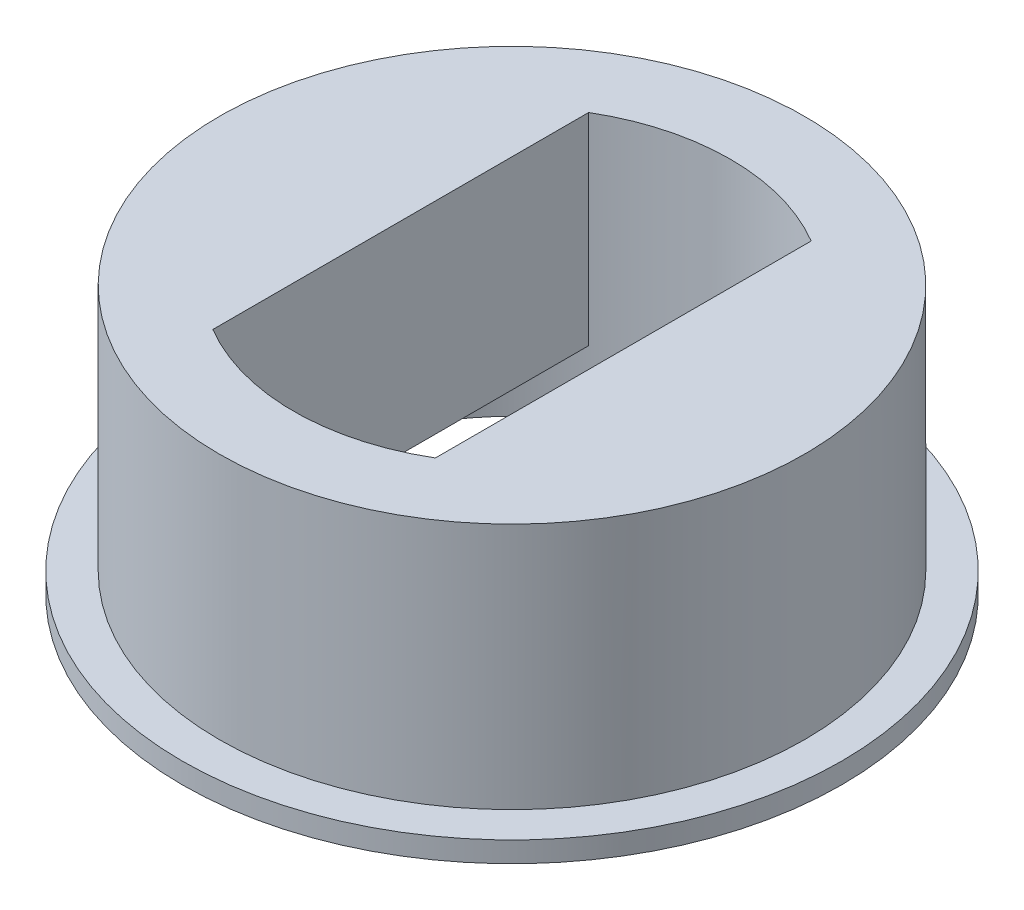
from build123d import *

# Parameters (mm, degrees)
SKETCH1_R           = 7
BOSS_EXTRUDE1_DEPTH = 7
SKETCH2_R           = 2.7
CUT_EXTRUDE2_DEPTH  = 10
SKETCH3_R           = 8
SKETCH3_W           = 5.4
SKETCH3_H           = 8.674169728
BOSS_EXTRUDE2_DEPTH = 1
SKETCH4_R           = 8
CUT_EXTRUDE3_DEPTH  = 0.5
SKETCH5_R           = 7.1
SKETCH5_W           = 5.4
SKETCH5_H           = 8.674169728
BOSS_EXTRUDE3_DEPTH = 6
SKETCH6_R           = 5.108845772
CUT_EXTRUDE4_DEPTH  = 1.1
CUT_EXTRUDE5_DEPTH  = 10.1
SKETCH9_R           = 5.298635414
CUT_EXTRUDE6_DEPTH  = 1.6
CUT_EXTRUDE7_DEPTH  = 10.6


with BuildPart() as part:
    # Sketch1 → Boss-Extrude1 (new body)
    with BuildSketch(Plane(origin=(0, 0, 0), x_dir=(1, 0, 0), z_dir=(0, 1, 0))):
        with Locations(Location((0, 0, 0), (0, 0, 270))):
            Circle(SKETCH1_R)
    extrude(amount=BOSS_EXTRUDE1_DEPTH)

    # Sketch2 → Cut-Extrude2 (cut)
    with BuildSketch(Plane.XZ):
        with BuildLine():
            Line((2.7, 4.337084864), (-2.7, 4.337084864))
            Line((-2.7, 4.337084864), (-2.7, 0))
            ThreePointArc((-2.7, 0), (0, 2.7), (2.7, 0))
            Line((2.7, 0), (2.7, 4.337084864))
        make_face()
        with BuildLine():
            ThreePointArc((2.7, 0), (0, -2.7), (-2.7, 0))
            Line((-2.7, 0), (-2.7, -4.337084864))
            Line((-2.7, -4.337084864), (2.7, -4.337084864))
            Line((2.7, -4.337084864), (2.7, 0))
        make_face()
        Circle(SKETCH2_R)
    extrude(amount=-CUT_EXTRUDE2_DEPTH, mode=Mode.SUBTRACT)

    # Sketch3 → Boss-Extrude2 (add)
    with BuildSketch(Plane.XZ):
        with Locations(Location((0, 0, 0), (0, 0, 270))):
            Circle(SKETCH3_R)
        Rectangle(SKETCH3_W, SKETCH3_H, mode=Mode.SUBTRACT)
    extrude(amount=-BOSS_EXTRUDE2_DEPTH)

    # Sketch4 → Cut-Extrude3 (cut)
    with BuildSketch(Plane.XZ):
        with Locations(Location((0, 0, 0), (0, 0, 270))):
            Circle(SKETCH4_R)
    extrude(amount=-CUT_EXTRUDE3_DEPTH, mode=Mode.SUBTRACT)

    # Sketch5 → Boss-Extrude3 (add)
    with BuildSketch(Plane(origin=(0, 7, 0), x_dir=(1, 0, 0), z_dir=(0, 1, 0))):
        with Locations(Location((0, 0, 0), (0, 0, 270))):
            Circle(SKETCH5_R)
        Rectangle(SKETCH5_W, SKETCH5_H, mode=Mode.SUBTRACT)
    extrude(amount=-BOSS_EXTRUDE3_DEPTH)

    # Sketch6 → Cut-Extrude4 (cut)
    with BuildSketch(Plane.XZ.offset(-0.5)):
        with Locations(Location((0, 0, 0), (0, 0, 270))):
            Circle(SKETCH6_R)
    extrude(amount=-CUT_EXTRUDE4_DEPTH, mode=Mode.SUBTRACT)

    # Sketch8 → Cut-Extrude5 (cut)
    with BuildSketch(Plane.XZ.offset(-1.6)):
        with BuildLine():
            Line((-2.7, 4.337084864), (2.7, 4.337084864))
            ThreePointArc((2.7, 4.337084864), (0, 5.108845772), (-2.7, 4.337084864))
        make_face()
        with BuildLine():
            Line((2.7, -4.337084864), (-2.7, -4.337084864))
            ThreePointArc((-2.7, -4.337084864), (0, -5.108845772), (2.7, -4.337084864))
        make_face()
    extrude(amount=-CUT_EXTRUDE5_DEPTH, mode=Mode.SUBTRACT)

    # Sketch9 → Cut-Extrude6 (cut)
    with BuildSketch(Plane.XZ.offset(-0.5)):
        with Locations(Location((0, 0, 0), (0, 0, 270))):
            Circle(SKETCH9_R)
    extrude(amount=-CUT_EXTRUDE6_DEPTH, mode=Mode.SUBTRACT)

    # Sketch10 → Cut-Extrude7 (cut)
    with BuildSketch(Plane.XZ.offset(-2.1)):
        with BuildLine():
            Line((-2.7, -4.337084864), (-2.7, -4.55911584))
            ThreePointArc((-2.7, -4.55911584), (0, -5.298635414), (2.7, -4.55911584))
            Line((2.7, -4.55911584), (2.7, -4.337084864))
            ThreePointArc((2.7, -4.337084864), (0, -5.108845772), (-2.7, -4.337084864))
        make_face()
        with BuildLine():
            Line((-2.7, 4.55911584), (-2.7, 4.337084864))
            ThreePointArc((-2.7, 4.337084864), (0, 5.108845772), (2.7, 4.337084864))
            Line((2.7, 4.337084864), (2.7, 4.55911584))
            ThreePointArc((2.7, 4.55911584), (0, 5.298635414), (-2.7, 4.55911584))
        make_face()
    extrude(amount=-CUT_EXTRUDE7_DEPTH, mode=Mode.SUBTRACT)


solid = part.part
